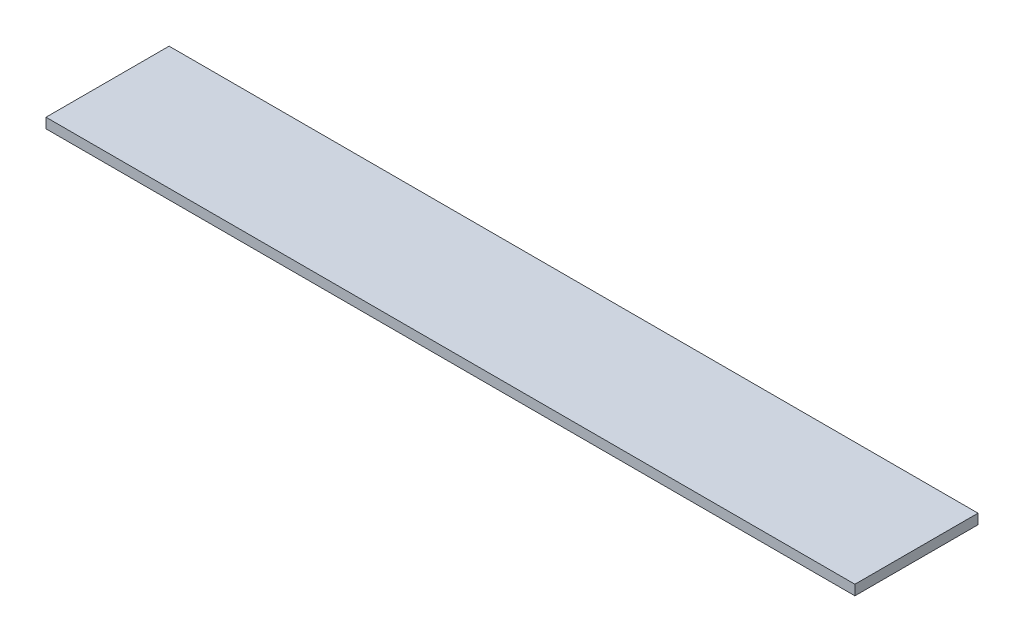
from build123d import *

# Parameters (mm, degrees)
SKETCH3_W           = 184
SKETCH3_H           = 2.289870314
BOSS_EXTRUDE1_DEPTH = 28


with BuildPart() as part:
    # Sketch3 → Boss-Extrude1 (new body)
    with BuildSketch(Plane.XY):
        with Locations((92, -1.144935157)):
            Rectangle(SKETCH3_W, SKETCH3_H)
    extrude(amount=BOSS_EXTRUDE1_DEPTH)


solid = part.part
